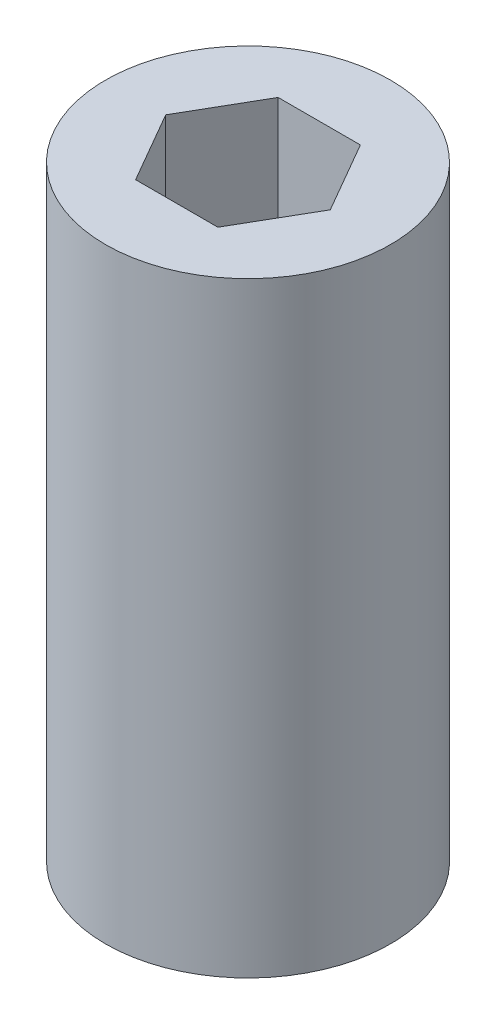
from build123d import *

# Parameters (mm, degrees)
SKETCH1_R           = 12.7
BOSS_EXTRUDE1_DEPTH = 53.975


with BuildPart() as part:
    # Sketch1 → Boss-Extrude1 (new body)
    with BuildSketch(Plane(origin=(0, 0, 0), x_dir=(1, 0, 0), z_dir=(0, 1, 0))):
        with Locations(Location((0, 0, 0), (0, 0, 270))):
            Circle(SKETCH1_R)
        Polygon((3.666174209, -6.35), (7.332348419, 0), (3.666174209, 6.35), (-3.666174209, 6.35), (-7.332348419, 0), (-3.666174209, -6.35), align=None, mode=Mode.SUBTRACT)
    extrude(amount=BOSS_EXTRUDE1_DEPTH)


solid = part.part
